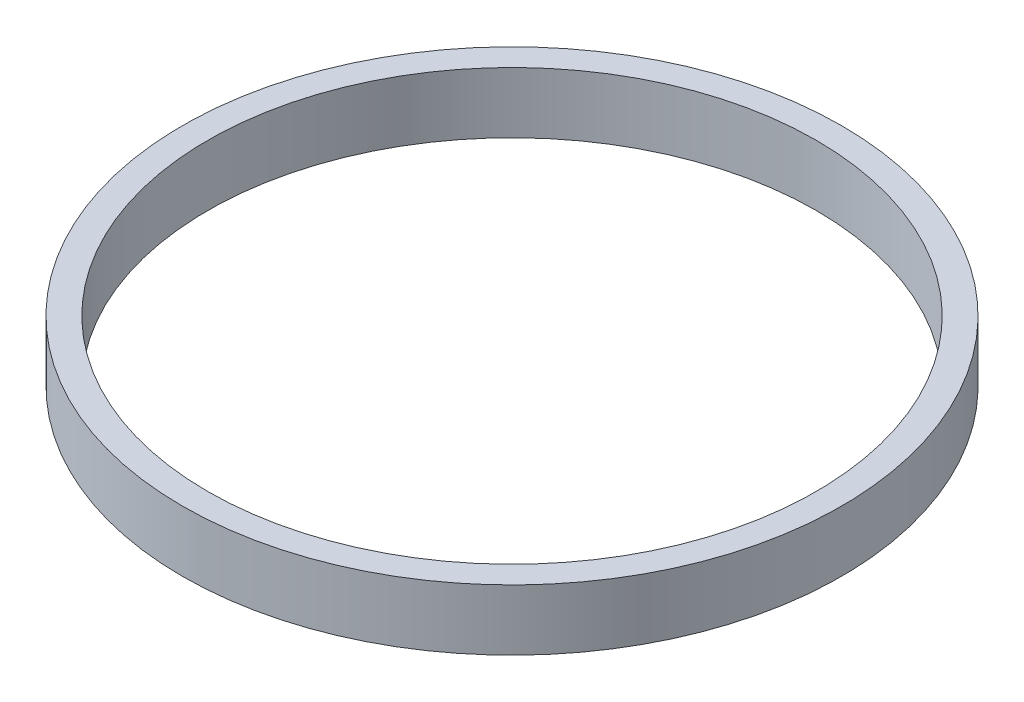
from build123d import *

# Parameters (mm, degrees)
SKETCH1_R           = 32.5
SKETCH1_R_2         = 30
BOSS_EXTRUDE1_DEPTH = 6


with BuildPart() as part:
    # Sketch1 → Boss-Extrude1 (new body)
    with BuildSketch(Plane(origin=(0, 0, 0), x_dir=(1, 0, 0), z_dir=(0, 1, 0))):
        with Locations(Location((0, 0, 0), (0, 0, 270))):
            Circle(SKETCH1_R)
        with Locations(Location((0, 0, 0), (0, 0, 270))):
            Circle(SKETCH1_R_2, mode=Mode.SUBTRACT)
    extrude(amount=BOSS_EXTRUDE1_DEPTH)


solid = part.part
